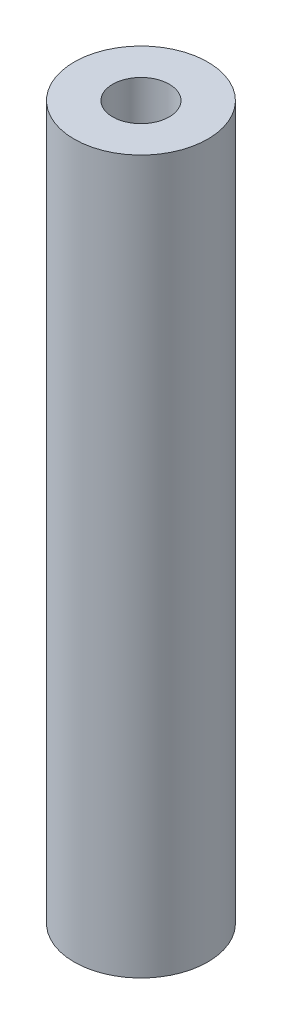
from build123d import *

# Parameters (mm, degrees)
SKETCH1_R                            = 4.7625
BOSS_EXTRUDE1_DEPTH                  = 25.4
F_10_32_TAPPED_HOLE1_D               = 4.0386
F_10_32_TAPPED_HOLE1_DEPTH           = 11.938
F_10_32_TAPPED_HOLE1_TIP             = 1.213317848
F_10_32_TAPPED_HOLE1_ON_FACE_2_D     = 4.0386
F_10_32_TAPPED_HOLE1_ON_FACE_2_DEPTH = 11.938
F_10_32_TAPPED_HOLE1_ON_FACE_2_TIP   = 1.213317848


with BuildPart() as part:
    # Sketch1 → Boss-Extrude1 (new, symmetric)
    with BuildSketch(Plane(origin=(0, 0, 0), x_dir=(1, 0, 0), z_dir=(0, 1, 0))):
        with Locations(Location((0, 0, 0), (0, 0, 270))):
            Circle(SKETCH1_R)
    extrude(amount=BOSS_EXTRUDE1_DEPTH, both=True)

    # #10-32 Tapped Hole1
    with Locations(Plane(origin=(0, -25.4, 0), x_dir=(0, 0, -1), z_dir=(0, -1, 0))):
        with Locations((0, 0)):
            Hole(F_10_32_TAPPED_HOLE1_D / 2, depth=F_10_32_TAPPED_HOLE1_DEPTH)
            with Locations((0, 0, -(F_10_32_TAPPED_HOLE1_DEPTH + F_10_32_TAPPED_HOLE1_TIP / 2))):  # 118° drill point
                Cone(0, F_10_32_TAPPED_HOLE1_D / 2, F_10_32_TAPPED_HOLE1_TIP, mode=Mode.SUBTRACT)

    # #10-32 Tapped Hole1 on face 2
    with Locations(Plane.ZX.offset(25.4)):
        with Locations((0, 0)):
            Hole(F_10_32_TAPPED_HOLE1_ON_FACE_2_D / 2, depth=F_10_32_TAPPED_HOLE1_ON_FACE_2_DEPTH)
            with Locations((0, 0, -(F_10_32_TAPPED_HOLE1_ON_FACE_2_DEPTH + F_10_32_TAPPED_HOLE1_ON_FACE_2_TIP / 2))):  # 118° drill point
                Cone(0, F_10_32_TAPPED_HOLE1_ON_FACE_2_D / 2, F_10_32_TAPPED_HOLE1_ON_FACE_2_TIP, mode=Mode.SUBTRACT)


solid = part.part
